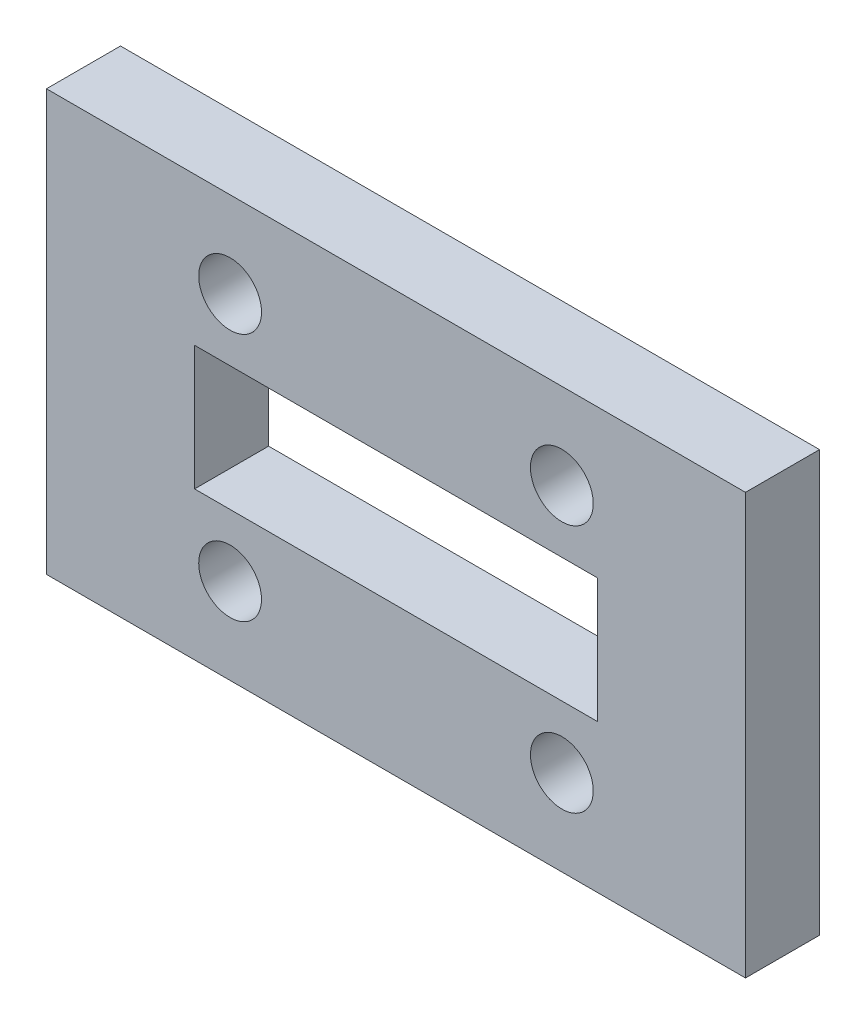
from build123d import *

# Parameters (mm, degrees)
SKETCH2_W           = 29.972
SKETCH2_H           = 18.034
SKETCH2_R           = 1.3462
SKETCH2_W_2         = 17.272
SKETCH2_H_2         = 5.334
BOSS_EXTRUDE1_DEPTH = 3.175


with BuildPart() as part:
    # Sketch2 → Boss-Extrude1 (new body)
    with BuildSketch(Plane.XY):
        Rectangle(SKETCH2_W, SKETCH2_H)
        with Locations((-7.112, 5.334)):
            Circle(SKETCH2_R, mode=Mode.SUBTRACT)
        with Locations(Location((7.112, 5.334, 0), (0, 0, 180))):
            Circle(SKETCH2_R, mode=Mode.SUBTRACT)
        with Locations((7.112, -5.334)):
            Circle(SKETCH2_R, mode=Mode.SUBTRACT)
        with Locations(Location((-7.112, -5.334, 0), (0, 0, 180))):
            Circle(SKETCH2_R, mode=Mode.SUBTRACT)
        Rectangle(SKETCH2_W_2, SKETCH2_H_2, mode=Mode.SUBTRACT)
    extrude(amount=BOSS_EXTRUDE1_DEPTH)


solid = part.part
